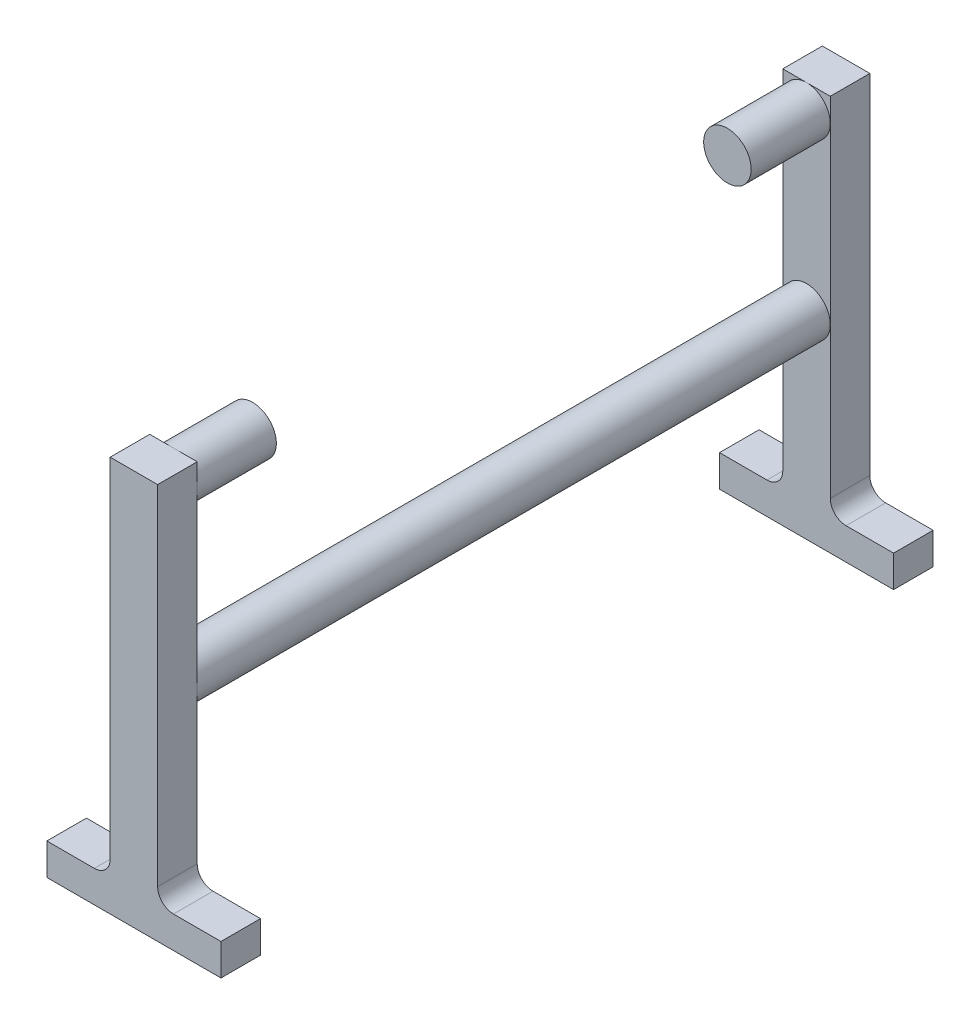
from build123d import *

# Parameters (mm, degrees)
SKETCH1_R            = 3
BOSS_EXTRUDE1_DEPTH  = 40
SKETCH2_W            = 6
SKETCH2_H            = 50
BOSS_EXTRUDE2_DEPTH  = 5
SKETCH9_W            = 22
SKETCH9_H            = 5
BOSS_EXTRUDE5_DEPTH  = 4
FILLET1_R            = 2
SKETCH11_R           = 3
BOSS_EXTRUDE7_DEPTH  = 10
FILLET1_OF_MIRROR5_R = 2


with BuildPart() as part:
    # Sketch1 → Boss-Extrude1 (new, symmetric)
    with BuildSketch(Plane.XY):
        Circle(SKETCH1_R)
    extrude(amount=BOSS_EXTRUDE1_DEPTH, both=True)

    # Sketch2 → Boss-Extrude2 (add)
    with BuildSketch(Plane.XY.offset(40)):
        Rectangle(SKETCH2_W, SKETCH2_H)
    boss_extrude2 = extrude(amount=BOSS_EXTRUDE2_DEPTH)

    # Sketch9 → Boss-Extrude5 (add)
    with BuildSketch(Plane.XZ.offset(25)):
        with Locations((0, 42.5)):
            Rectangle(SKETCH9_W, SKETCH9_H)
    boss_extrude5 = extrude(amount=-BOSS_EXTRUDE5_DEPTH)

    # Fillet1
    fillet1_edges = [part.edges().sort_by_distance(p)[0] for p in [
        (-3, -21, 42.5),
        (3, -21, 42.5),
    ]]
    fillet(fillet1_edges, radius=FILLET1_R)

    # Sketch11 → Boss-Extrude7 (add)
    with BuildSketch(Plane(origin=(0, 0, 40), x_dir=(-1, 0, 0), z_dir=(0, 0, -1))):
        with Locations((0, 22)):
            Circle(SKETCH11_R)
    boss_extrude7 = extrude(amount=BOSS_EXTRUDE7_DEPTH)

    # Mirror5: Boss-Extrude2, Boss-Extrude5, Boss-Extrude7 across plane
    add(boss_extrude2.mirror(Plane.XY))
    add(boss_extrude5.mirror(Plane.XY))
    add(boss_extrude7.mirror(Plane.XY))

    # Fillet1 of Mirror5
    fillet1_of_mirror5_edges = [part.edges().sort_by_distance(p)[0] for p in [
        (-3, -21, -42.5),
        (3, -21, -42.5),
    ]]
    fillet(fillet1_of_mirror5_edges, radius=FILLET1_OF_MIRROR5_R)

    # Mirror1: Boss-Extrude2 across plane
    add(boss_extrude2.mirror(Plane.XY))


solid = part.part
